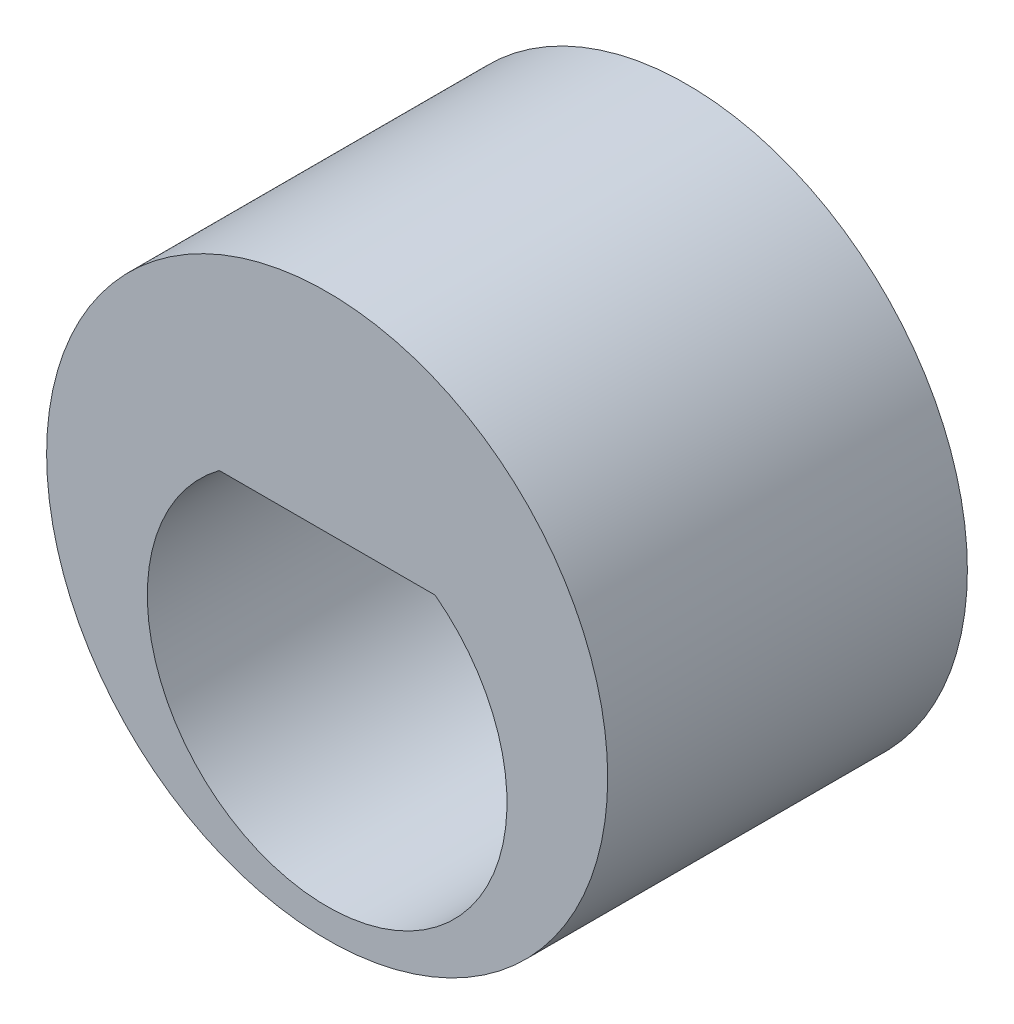
from build123d import *

# Parameters (mm, degrees)
ESQUISSE1_R        = 3.9
BOSS_EXTRU_1_DEPTH = 5


with BuildPart() as part:
    # Esquisse1 → Boss.-Extru.1 (new body)
    with BuildSketch(Plane.XY):
        with Locations((0, 1)):
            Circle(ESQUISSE1_R)
        with BuildLine():
            Line((-1.5, 2), (1.5, 2))
            ThreePointArc((1.5, 2), (0, -2.5), (-1.5, 2))
        make_face(mode=Mode.SUBTRACT)
    extrude(amount=BOSS_EXTRU_1_DEPTH)


solid = part.part
